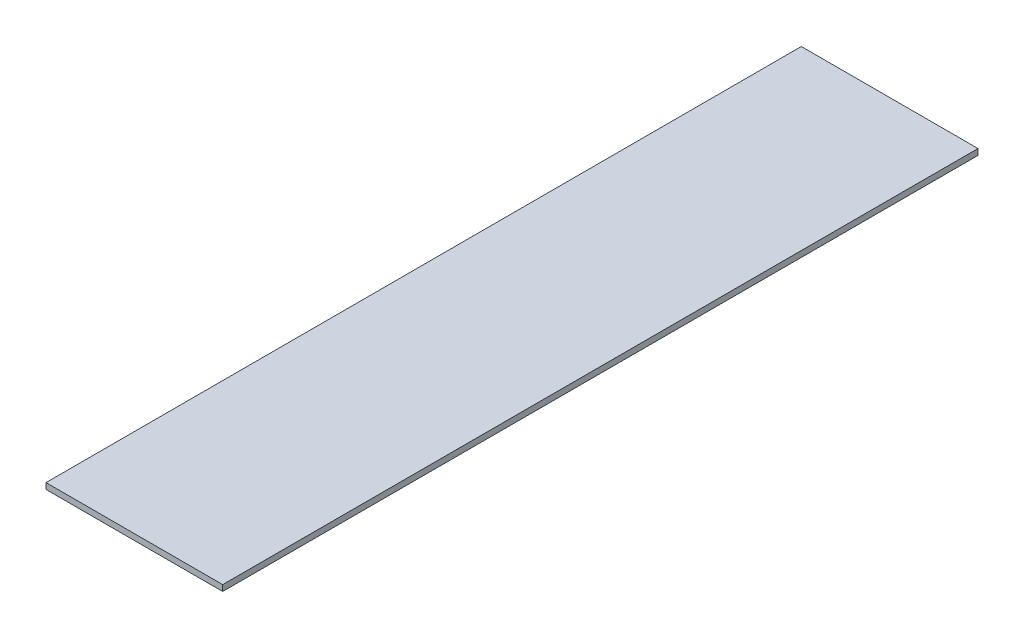
from build123d import *

# Parameters (mm, degrees)
SKETCH2_W           = 133.1
SKETCH2_H           = 569
BOSS_EXTRUDE1_DEPTH = 4.5


with BuildPart() as part:
    # Sketch2 → Boss-Extrude1 (new body)
    with BuildSketch(Plane(origin=(0, 0, 0), x_dir=(1, 0, 0), z_dir=(0, 1, 0))):
        Rectangle(SKETCH2_W, SKETCH2_H)
    extrude(amount=BOSS_EXTRUDE1_DEPTH)


solid = part.part
